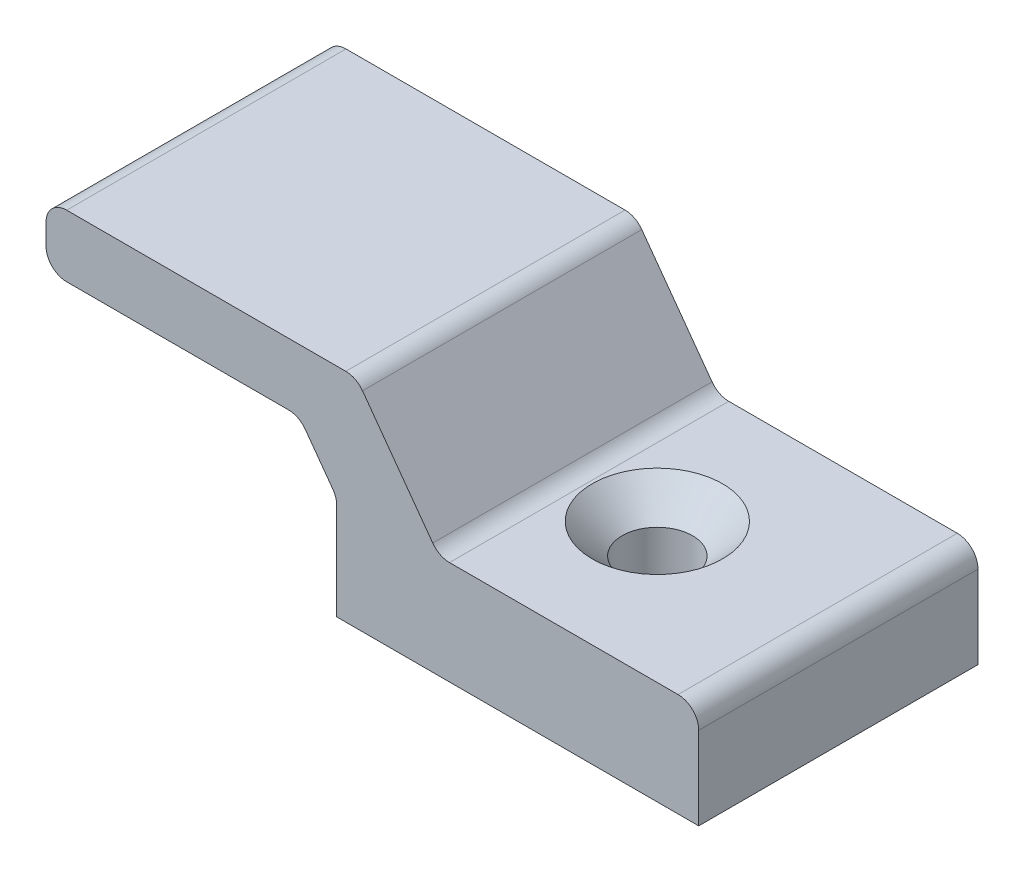
from build123d import *

# Parameters (mm, degrees)
EXTRUDE_442_DEPTH          = 13.5
FILLET_1_R                 = 1
HOLE_WIZARD_M3_D           = 3.4
HOLE_WIZARD_M3_CSINK_D     = 6.3
HOLE_WIZARD_M3_CSINK_ANGLE = 90


with BuildPart() as part:
    # Эскиз1 → Extrude 442 (new body)
    with BuildSketch(Plane.XY):
        Polygon((8.75, 0), (-8.75, 0), (-8.75, 5), (-10.564997351, 7.5), (-22.8, 7.5), (-22.8, 10.5), (-7.8, 10.5), (-3.807005828, 5), (8.75, 5), align=None)
    extrude(amount=EXTRUDE_442_DEPTH)

    # Скругление1
    fillet_1_edges = [part.edges().sort_by_distance(p)[0] for p in [
        (-8.75, 5, 6.75),
        (-10.564997351, 7.5, 6.75),
        (-22.8, 7.5, 6.75),
        (-22.8, 10.5, 6.75),
        (-7.8, 10.5, 6.75),
        (-3.807005828, 5, 6.75),
        (8.75, 5, 6.75),
    ]]
    fillet(fillet_1_edges, radius=FILLET_1_R)

    # Крепление-M3 (through all)
    with Locations(Plane(origin=(0, 5, 0), x_dir=(1, 0, 0), z_dir=(0, 1, 0))):
        with Locations((0, -6.75)):
            CounterSinkHole(HOLE_WIZARD_M3_D / 2, HOLE_WIZARD_M3_CSINK_D / 2, counter_sink_angle=HOLE_WIZARD_M3_CSINK_ANGLE)


solid = part.part
